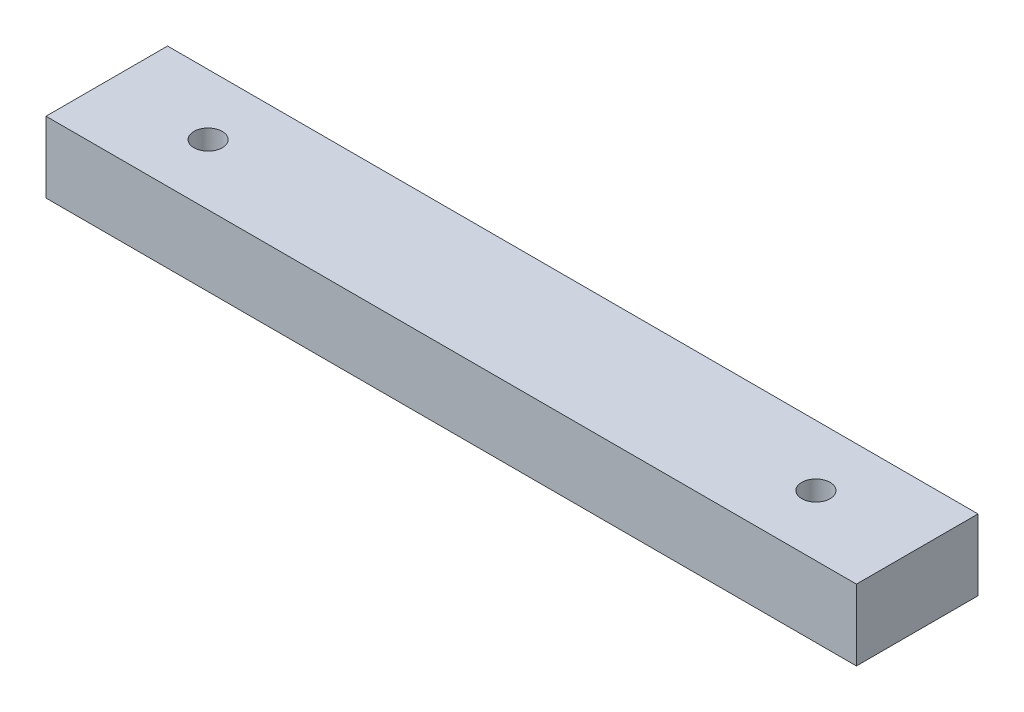
from build123d import *

# Parameters (mm, degrees)
SKETCH1_W                         = 400
SKETCH1_H                         = 60
BOSS_EXTRUDE1_DEPTH               = 35
SKETCH2_R                         = 7
CUT_EXTRUDE1_DEPTH                = 206.243757518
F_1_4_20_TAPPED_HOLE1_D           = 5.1054
F_1_4_20_TAPPED_HOLE1_DEPTH       = 18
F_1_4_20_TAPPED_HOLE1_CSINK_D     = 7.62
F_1_4_20_TAPPED_HOLE1_CSINK_ANGLE = 90
F_1_4_20_TAPPED_HOLE1_TIP         = 1.533816902


with BuildPart() as part:
    # Sketch1 → Boss-Extrude1 (new body)
    with BuildSketch(Plane(origin=(0, 0, 0), x_dir=(1, 0, 0), z_dir=(0, 1, 0))):
        Rectangle(SKETCH1_W, SKETCH1_H)
    extrude(amount=BOSS_EXTRUDE1_DEPTH)

    # Sketch2 → Cut-Extrude1 (cut, through all)
    with BuildSketch(Plane(origin=(0, 35, 0), x_dir=(1, 0, 0), z_dir=(0, 1, 0))):
        with Locations(Location((-150, 0, 0), (0, 0, 270))):
            Circle(SKETCH2_R)
        with Locations(Location((150, 0, 0), (0, 0, 270))):
            Circle(SKETCH2_R)
    extrude(amount=-CUT_EXTRUDE1_DEPTH, mode=Mode.SUBTRACT)

    # 1/4-20 Tapped Hole1
    with Locations(Plane.XZ):
        with Locations((-168.77, 18.77), (-131.23, 18.77), (-131.23, -18.77), (-168.77, -18.77), (131.23, 18.77), (168.77, 18.77), (168.77, -18.77), (131.23, -18.77)):
            CounterSinkHole(F_1_4_20_TAPPED_HOLE1_D / 2, F_1_4_20_TAPPED_HOLE1_CSINK_D / 2, depth=F_1_4_20_TAPPED_HOLE1_DEPTH, counter_sink_angle=F_1_4_20_TAPPED_HOLE1_CSINK_ANGLE)
            with Locations((0, 0, -(F_1_4_20_TAPPED_HOLE1_DEPTH + F_1_4_20_TAPPED_HOLE1_TIP / 2))):  # 118° drill point
                Cone(0, F_1_4_20_TAPPED_HOLE1_D / 2, F_1_4_20_TAPPED_HOLE1_TIP, mode=Mode.SUBTRACT)


solid = part.part
